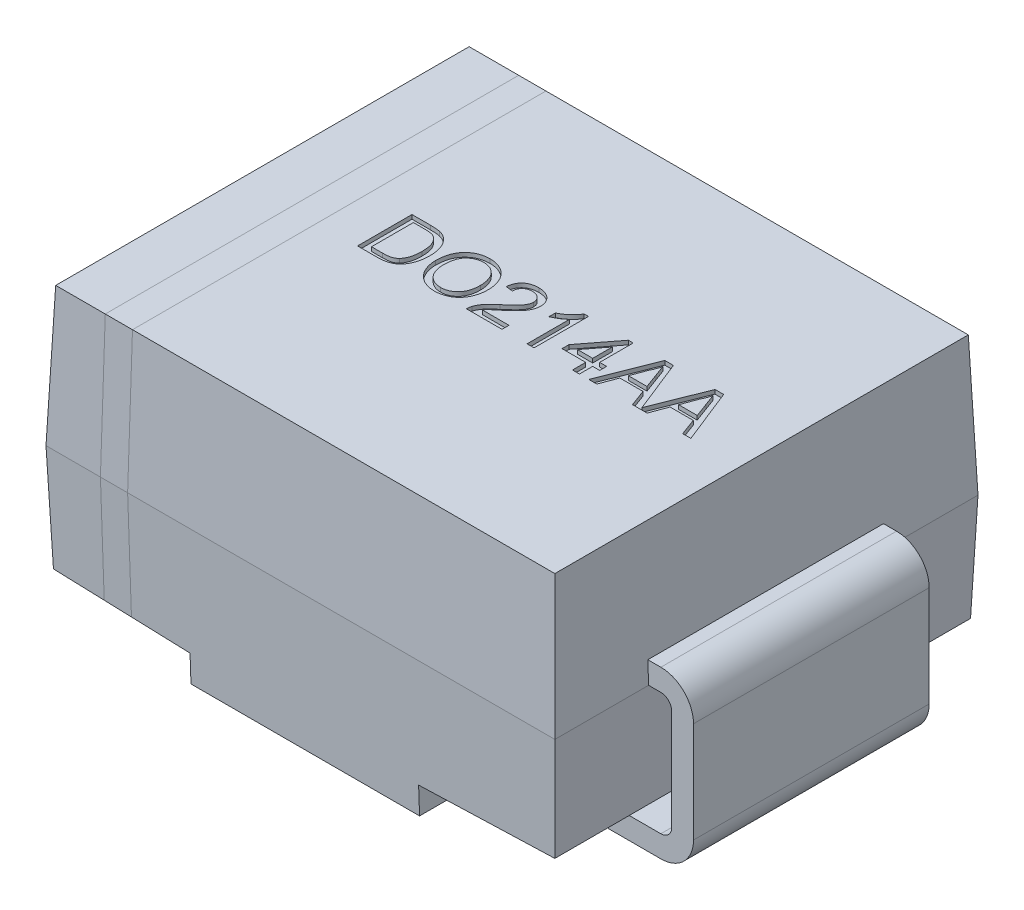
from build123d import *

# Parameters (mm, degrees)
SKETCH1_W                      = 4.7498
SKETCH1_H                      = 3.9497
EXTRUDE1_DEPTH                 = 1.2954
EXTRUDE1_TAPER                 = 2
EXTRUDE1_OTHER_WAY_DEPTH       = 1.2954
EXTRUDE1_OTHER_WAY_TAPER       = 2
CUT_EXTRUDE1_REACH             = 5.349
CUT_EXTRUDE1_DIRECTION_2_REACH = 5.349
EXTRUDE2_DEPTH                 = 1.09982
CUT_EXTRUDE2_DEPTH             = 0.0381


with BuildPart() as part:
    # Sketch1 → Extrude1 (new body)
    with BuildSketch(Plane(origin=(0, 0, 0), x_dir=(1, 0, 0), z_dir=(0, 1, 0))):
        Rectangle(SKETCH1_W, SKETCH1_H)
    extrude(amount=EXTRUDE1_DEPTH, taper=EXTRUDE1_TAPER)

    # Sketch1 → Extrude1 other way (add)
    with BuildSketch(Plane(origin=(0, 0, 0), x_dir=(1, 0, 0), z_dir=(0, 1, 0))):
        Rectangle(SKETCH1_W, SKETCH1_H)
    extrude(amount=-EXTRUDE1_OTHER_WAY_DEPTH, taper=EXTRUDE1_OTHER_WAY_TAPER)

    # Cut-Extrude1: up to this plane
    cut_extrude1_end = Plane(origin=(-2.3749, 0, 1.97485), z_dir=(0, -0.03489949670250105, 0.9993908270190958))
    # Sketch2 → Cut-Extrude1 (cut, up to the surface)
    with BuildSketch(Plane.XY, mode=Mode.PRIVATE) as cut_extrude1_sk1:
        Polygon((1.0668, -1.0414), (1.0668, -1.2954), (2.329663635, -1.2954), (2.340086232, -0.996935865), align=None)
    cut_extrude1_tool1 = split(extrude(cut_extrude1_sk1.sketch, amount=CUT_EXTRUDE1_REACH, mode=Mode.PRIVATE), bisect_by=cut_extrude1_end, keep=Keep.BOTH, mode=Mode.PRIVATE)
    add(cut_extrude1_tool1.solids().sort_by_distance((1.717786, -1.156813, 0))[0], mode=Mode.SUBTRACT)
    # Sketch2 → Cut-Extrude1 (cut, up to the surface)
    with BuildSketch(Plane.XY, mode=Mode.PRIVATE) as cut_extrude1_sk2:
        Polygon((-1.0668, -1.0414), (-1.0668, -1.2954), (-2.329663635, -1.2954), (-2.340086232, -0.996935865), align=None)
    cut_extrude1_tool2 = split(extrude(cut_extrude1_sk2.sketch, amount=CUT_EXTRUDE1_REACH, mode=Mode.PRIVATE), bisect_by=cut_extrude1_end, keep=Keep.BOTH, mode=Mode.PRIVATE)
    add(cut_extrude1_tool2.solids().sort_by_distance((-1.717786, -1.156813, 0))[0], mode=Mode.SUBTRACT)

    # Cut-Extrude1 direction 2: up to this plane
    cut_extrude1_direction_2_end = Plane(origin=(-2.3749, 0, -1.97485), z_dir=(0, -0.034899496702501046, -0.9993908270190958))
    # Sketch2 → Cut-Extrude1 direction 2 (cut, up to the surface)
    with BuildSketch(Plane.XY, mode=Mode.PRIVATE) as cut_extrude1_direction_2_sk1:
        Polygon((1.0668, -1.0414), (1.0668, -1.2954), (2.329663635, -1.2954), (2.340086232, -0.996935865), align=None)
    cut_extrude1_direction_2_tool1 = split(extrude(cut_extrude1_direction_2_sk1.sketch, amount=-CUT_EXTRUDE1_DIRECTION_2_REACH, mode=Mode.PRIVATE), bisect_by=cut_extrude1_direction_2_end, keep=Keep.BOTH, mode=Mode.PRIVATE)
    add(cut_extrude1_direction_2_tool1.solids().sort_by_distance((1.717786, -1.156813, 0))[0], mode=Mode.SUBTRACT)
    # Sketch2 → Cut-Extrude1 direction 2 (cut, up to the surface)
    with BuildSketch(Plane.XY, mode=Mode.PRIVATE) as cut_extrude1_direction_2_sk2:
        Polygon((-1.0668, -1.0414), (-1.0668, -1.2954), (-2.329663635, -1.2954), (-2.340086232, -0.996935865), align=None)
    cut_extrude1_direction_2_tool2 = split(extrude(cut_extrude1_direction_2_sk2.sketch, amount=-CUT_EXTRUDE1_DIRECTION_2_REACH, mode=Mode.PRIVATE), bisect_by=cut_extrude1_direction_2_end, keep=Keep.BOTH, mode=Mode.PRIVATE)
    add(cut_extrude1_direction_2_tool2.solids().sort_by_distance((-1.717786, -1.156813, 0))[0], mode=Mode.SUBTRACT)

    # Sketch3 → Extrude2 (add, symmetric)
    with BuildSketch(Plane.XY):
        with BuildLine():
            Line((2.3678041, 0.2032), (2.4892, 0.2032))
            ThreePointArc((2.4892, 0.2032), (2.704726147, 0.113926147), (2.794, -0.1016))
            Line((2.794, -0.1016), (2.794, -1.0414))
            ThreePointArc((2.794, -1.0414), (2.704726147, -1.256926147), (2.4892, -1.3462))
            Line((2.4892, -1.3462), (1.5367, -1.3462))
            Line((1.5367, -1.3462), (1.5367, -1.143))
            Line((1.5367, -1.143), (2.4892, -1.143))
            ThreePointArc((2.4892, -1.143), (2.561042049, -1.113242049), (2.5908, -1.0414))
            Line((2.5908, -1.0414), (2.5908, -0.1016))
            ThreePointArc((2.5908, -0.1016), (2.561042049, -0.029757951), (2.4892, 0))
            Line((2.4892, 0), (2.3749, 0))
            Line((2.3749, 0), (2.3678041, 0.2032))
        make_face()
        with BuildLine():
            Line((-2.367463797, 0.212944979), (-2.3749, 0))
            Line((-2.3749, 0), (-2.4892, 0))
            ThreePointArc((-2.4892, 0), (-2.561042049, -0.029757951), (-2.5908, -0.1016))
            Line((-2.5908, -0.1016), (-2.5908, -1.0414))
            ThreePointArc((-2.5908, -1.0414), (-2.561042049, -1.113242049), (-2.4892, -1.143))
            Line((-2.4892, -1.143), (-1.5367, -1.143))
            Line((-1.5367, -1.143), (-1.5367, -1.3462))
            Line((-1.5367, -1.3462), (-2.4892, -1.3462))
            ThreePointArc((-2.4892, -1.3462), (-2.704726147, -1.256926147), (-2.794, -1.0414))
            Line((-2.794, -1.0414), (-2.794, -0.1016))
            ThreePointArc((-2.794, -0.1016), (-2.704726147, 0.113926147), (-2.4892, 0.2032))
            Line((-2.4892, 0.2032), (-2.367463797, 0.212944979))
        make_face()
    extrude(amount=EXTRUDE2_DEPTH, both=True)

    # Sketch5 → Cut-Extrude2 (cut)
    # profile 1 of 7: a face of its own
    with BuildSketch(Plane(origin=(0, 1.2954, 0), x_dir=(1, 0, 0), z_dir=(0, 1, 0))):
        with BuildLine():
            Line((-1.239701999, -0.201883132), (-1.239701999, 0.306116868))
            Line((-1.239701999, 0.306116868), (-1.065992864, 0.306116868))
            add(Edge.make_bspline(
                [(-1.065992864, 0.306116868), (-1.061243888, 0.306095414), (-1.052016264, 0.306053727), (-1.038612202, 0.305788039), (-1.026061099, 0.305147202), (-1.014420787, 0.304366578), (-1.003632561, 0.303327244), (-0.993710201, 0.30216501), (-0.984645968, 0.300649027), (-0.978947184, 0.299388963), (-0.976238057, 0.298789945)],
                knots=[0, 0, 0, 0, 1.263127796, 2.454354013, 3.565393221, 4.605443485, 5.557051711, 6.447822442, 7.26211484, 8, 8, 8, 8], degree=3))
            add(Edge.make_bspline(
                [(-0.976238057, 0.298789945), (-0.969231785, 0.296951768), (-0.95546728, 0.293340489), (-0.936037234, 0.285217384), (-0.918199605, 0.275028432), (-0.907620769, 0.266635663), (-0.902358249, 0.262460618)],
                knots=[0, 0, 0, 0, 1.04477941, 2.052571232, 3.03123721, 4, 4, 4, 4], degree=3))
            add(Edge.make_bspline(
                [(-0.902358249, 0.262460618), (-0.89909078, 0.25959125), (-0.892541052, 0.253839526), (-0.88354504, 0.24436314), (-0.875199588, 0.234310235), (-0.86725543, 0.22385388), (-0.860220668, 0.212612863), (-0.853626566, 0.200910731), (-0.847874912, 0.188512489), (-0.842580601, 0.175620761), (-0.837863731, 0.162185298), (-0.833988043, 0.148214777), (-0.83042752, 0.133855083), (-0.827779317, 0.11894925), (-0.825467573, 0.103623709), (-0.824000015, 0.087790743), (-0.823047815, 0.071497617), (-0.822937469, 0.060462837), (-0.822881486, 0.054864464)],
                knots=[0, 0, 0, 0, 0.908997367, 1.822109427, 2.728529095, 3.640759027, 4.565643067, 5.499218265, 6.448003669, 7.421473682, 8.413047621, 9.423472075, 10.452328391, 11.505545429, 12.587978234, 13.692612971, 14.829372988, 16, 16, 16, 16], degree=3))
            add(Edge.make_bspline(
                [(-0.822881486, 0.054864464), (-0.823017946, 0.045495698), (-0.823283494, 0.027264299), (-0.825909664, 0.000747068), (-0.829973439, -0.024178261), (-0.835887689, -0.047362018), (-0.843171704, -0.06867562), (-0.851117933, -0.088293138), (-0.860264607, -0.105876545), (-0.870298303, -0.121574478), (-0.881049143, -0.135486258), (-0.892311923, -0.147820678), (-0.904120032, -0.158583197), (-0.916413485, -0.168056265), (-0.929830751, -0.175900226), (-0.944231069, -0.182943442), (-0.960081634, -0.188602663), (-0.977083949, -0.193552909), (-0.995437713, -0.197261514), (-1.01504354, -0.199986716), (-1.035978483, -0.20163468), (-1.050352268, -0.20179871), (-1.057750076, -0.201883132)],
                knots=[0, 0, 0, 0, 1.410753827, 2.745293735, 4.009435601, 5.211453015, 6.344066657, 7.400119332, 8.396481539, 9.324811333, 10.202671465, 11.041621015, 11.837259285, 12.606727868, 13.374311266, 14.17412185, 15.017911533, 15.905707008, 16.839601966, 17.835295848, 18.885883805, 20, 20, 20, 20], degree=3))
            Line((-1.057750076, -0.201883132), (-1.239701999, -0.201883132))
        make_face()
        with BuildLine():
            Line((-1.168060973, -0.143267747), (-1.063347031, -0.143267747))
            add(Edge.make_bspline(
                [(-1.063347031, -0.143267747), (-1.055711551, -0.143153447), (-1.041266923, -0.142937217), (-1.020887835, -0.141276575), (-1.003101588, -0.138412191), (-0.987710951, -0.134336945), (-0.974357171, -0.129067027), (-0.962599102, -0.122836724), (-0.952140153, -0.115766731), (-0.946248626, -0.110110441), (-0.943368665, -0.107345472)],
                knots=[0, 0, 0, 0, 1.423649224, 2.693227144, 3.808972214, 4.778671344, 5.656058397, 6.479437267, 7.256702014, 8, 8, 8, 8], degree=3))
            add(Edge.make_bspline(
                [(-0.943368665, -0.107345472), (-0.939620972, -0.103060267), (-0.93192192, -0.094256983), (-0.922334603, -0.078878113), (-0.913973997, -0.06157394), (-0.906985005, -0.04216025), (-0.901254212, -0.020702708), (-0.897431992, 0.002990885), (-0.894932992, 0.028759424), (-0.894662746, 0.04668306), (-0.894522512, 0.055983855)],
                knots=[0, 0, 0, 0, 0.782184731, 1.606876467, 2.483531085, 3.422528604, 4.441347086, 5.534669947, 6.720709839, 8, 8, 8, 8], degree=3))
            add(Edge.make_bspline(
                [(-0.894522512, 0.055983855), (-0.8946094, 0.062463826), (-0.894778307, 0.075060626), (-0.895831299, 0.093412052), (-0.89791006, 0.11058715), (-0.900568601, 0.126615628), (-0.904198421, 0.141446535), (-0.908349183, 0.155221969), (-0.913570985, 0.16776185), (-0.9195297, 0.179162987), (-0.92606648, 0.189501095), (-0.93287804, 0.19899823), (-0.939999237, 0.207623254), (-0.947580964, 0.215253449), (-0.955395306, 0.222114456), (-0.963587943, 0.228065808), (-0.972135949, 0.233105676), (-0.978142578, 0.23572191), (-0.981122672, 0.237019913)],
                knots=[0, 0, 0, 0, 1.460126857, 2.838427476, 4.139102445, 5.35666337, 6.496721546, 7.577303074, 8.594995104, 9.55219858, 10.472533725, 11.348579167, 12.184287935, 12.989560785, 13.769667798, 14.524891986, 15.268148459, 16, 16, 16, 16], degree=3))
            add(Edge.make_bspline(
                [(-0.981122672, 0.237019913), (-0.983451199, 0.237872053), (-0.988385196, 0.239677682), (-0.996437956, 0.241721383), (-1.005424918, 0.243602154), (-1.015434664, 0.24492221), (-1.026416568, 0.24620516), (-1.038438894, 0.246984783), (-1.051438591, 0.247338087), (-1.060429648, 0.247445805), (-1.065076999, 0.247501483)],
                knots=[0, 0, 0, 0, 0.699400087, 1.48198292, 2.341906832, 3.289648813, 4.329964754, 5.462247508, 6.688271602, 8, 8, 8, 8], degree=3))
            Line((-1.065076999, 0.247501483), (-1.168060973, 0.247501483))
            Line((-1.168060973, 0.247501483), (-1.168060973, -0.143267747))
        make_face(mode=Mode.SUBTRACT)
    # profile 2 of 7: a face of its own
    with BuildSketch(Plane(origin=(0, 1.2954, 0), x_dir=(1, 0, 0), z_dir=(0, 1, 0))):
        with BuildLine():
            add(Edge.make_bspline(
                [(-0.757753281, 0.045400522), (-0.75757672, 0.055585484), (-0.757232699, 0.075430366), (-0.754018329, 0.104327072), (-0.748799016, 0.131515092), (-0.741337548, 0.156992308), (-0.731880115, 0.180798644), (-0.720382798, 0.202988005), (-0.706499766, 0.223309223), (-0.69079452, 0.241955744), (-0.673252481, 0.258440635), (-0.654575195, 0.27308158), (-0.634529442, 0.285293859), (-0.613300429, 0.295377175), (-0.590797963, 0.303118853), (-0.567085224, 0.308538733), (-0.542187573, 0.312035082), (-0.525169446, 0.312428607), (-0.516473633, 0.312629689)],
                knots=[0, 0, 0, 0, 1.203621547, 2.345195544, 3.432004029, 4.472479546, 5.478447225, 6.455936844, 7.420185704, 8.381829745, 9.332027588, 10.260832629, 11.182364398, 12.100723901, 13.034044877, 13.989196293, 14.972532542, 16, 16, 16, 16], degree=3))
            add(Edge.make_bspline(
                [(-0.516473633, 0.312629689), (-0.510738148, 0.312529536), (-0.49934851, 0.312330652), (-0.482509948, 0.310817406), (-0.466104077, 0.308116525), (-0.450147054, 0.304497041), (-0.434595443, 0.299748436), (-0.419439958, 0.294142853), (-0.404813267, 0.287196745), (-0.390618063, 0.279419886), (-0.37702191, 0.270721134), (-0.36424428, 0.261111639), (-0.352315779, 0.250664079), (-0.341076174, 0.239550183), (-0.330900516, 0.227394872), (-0.321368422, 0.214568418), (-0.312753803, 0.200843388), (-0.305026092, 0.186332234), (-0.298116732, 0.171259078), (-0.292211351, 0.155561449), (-0.287140507, 0.139427651), (-0.282895784, 0.122762188), (-0.27985008, 0.105570759), (-0.277424753, 0.087927438), (-0.276148236, 0.069774563), (-0.275920087, 0.057511973), (-0.275804563, 0.051302765)],
                knots=[0, 0, 0, 0, 1.034375294, 2.054082248, 3.045783978, 4.031219655, 5.002789406, 5.976610191, 6.94273282, 7.920236376, 8.894345378, 9.851183672, 10.800797181, 11.752517031, 12.698794154, 13.65688337, 14.632873302, 15.61821402, 16.620222298, 17.621258913, 18.640965868, 19.669244166, 20.720417492, 21.788124603, 22.880008887, 24, 24, 24, 24], degree=3))
            add(Edge.make_bspline(
                [(-0.275804563, 0.051302765), (-0.275910408, 0.044991168), (-0.276119524, 0.03252152), (-0.277534486, 0.014100034), (-0.280022481, -0.003792609), (-0.283322383, -0.021209763), (-0.287744151, -0.038115167), (-0.292998743, -0.054557291), (-0.299354469, -0.070438203), (-0.306532555, -0.085796178), (-0.314654557, -0.100419991), (-0.323613676, -0.114207386), (-0.333416259, -0.127029392), (-0.343913407, -0.139043303), (-0.355350255, -0.150034288), (-0.367585974, -0.160105119), (-0.380573518, -0.169350778), (-0.394356518, -0.177520861), (-0.40868762, -0.184682231), (-0.423283234, -0.191035657), (-0.438154202, -0.196454111), (-0.453351348, -0.200845229), (-0.468833215, -0.204163474), (-0.484556237, -0.206648211), (-0.500571955, -0.208078932), (-0.511348839, -0.208289736), (-0.516778922, -0.208395953)],
                knots=[0, 0, 0, 0, 1.141429366, 2.255090526, 3.338676798, 4.407031443, 5.458968682, 6.496860253, 7.526652771, 8.550250826, 9.560787671, 10.54935636, 11.521089193, 12.477323897, 13.431786008, 14.386110112, 15.340986122, 16.312041, 17.28047646, 18.236612773, 19.189437236, 20.140779471, 21.09494583, 22.051062463, 23.018000708, 24, 24, 24, 24], degree=3))
            add(Edge.make_bspline(
                [(-0.516778922, -0.208395953), (-0.522617467, -0.208309571), (-0.534182162, -0.208138469), (-0.551275094, -0.206430589), (-0.56794278, -0.203825157), (-0.584136765, -0.200063701), (-0.59983492, -0.195156616), (-0.615055821, -0.189217236), (-0.629852999, -0.182324938), (-0.644042848, -0.174282374), (-0.65757707, -0.165339907), (-0.670324487, -0.15554199), (-0.682278049, -0.144978919), (-0.693245952, -0.1334761), (-0.703583412, -0.121450514), (-0.712877089, -0.108455178), (-0.721430501, -0.094784811), (-0.728990539, -0.080307639), (-0.735819902, -0.065453866), (-0.741573788, -0.050218743), (-0.746630338, -0.034826795), (-0.750657369, -0.019183151), (-0.753866422, -0.003323898), (-0.756024278, 0.012724574), (-0.757582698, 0.028986168), (-0.757696134, 0.039901536), (-0.757753281, 0.045400522)],
                knots=[0, 0, 0, 0, 1.072727997, 2.12480551, 3.153819198, 4.171534612, 5.177148798, 6.173931848, 7.17235114, 8.174500385, 9.168706755, 10.151274001, 11.127173509, 12.097141049, 13.070188938, 14.039134204, 15.03036519, 16.031505612, 17.038625933, 18.033164522, 19.022845559, 20.014762458, 21.000193215, 21.994692725, 22.989758729, 24, 24, 24, 24], degree=3))
        make_face()
        with BuildLine():
            add(Edge.make_bspline(
                [(-0.686112255, 0.044586419), (-0.686002469, 0.037252328), (-0.685788393, 0.022951366), (-0.683339249, 0.002101325), (-0.679623064, -0.01757175), (-0.674500696, -0.036123087), (-0.667614978, -0.053369216), (-0.659382211, -0.069475854), (-0.649525196, -0.084335935), (-0.638261407, -0.097907889), (-0.62587253, -0.110099915), (-0.612633758, -0.120749002), (-0.598542115, -0.129666858), (-0.583753832, -0.137030453), (-0.56816269, -0.14277841), (-0.551815387, -0.14681448), (-0.53469991, -0.149338715), (-0.523029266, -0.149631449), (-0.51708421, -0.149780568)],
                knots=[0, 0, 0, 0, 1.215430442, 2.370003584, 3.475209778, 4.53279855, 5.55522989, 6.548792651, 7.526809858, 8.505409025, 9.467826767, 10.404123909, 11.316848639, 12.227335424, 13.138360512, 14.065900994, 15.014765094, 16, 16, 16, 16], degree=3))
            add(Edge.make_bspline(
                [(-0.51708421, -0.149780568), (-0.511038386, -0.149629243), (-0.499200678, -0.149332949), (-0.481827163, -0.14685278), (-0.465320378, -0.142630397), (-0.449516712, -0.13700945), (-0.434701881, -0.129410887), (-0.420529407, -0.120513011), (-0.407385635, -0.109640062), (-0.394947921, -0.097426472), (-0.383792129, -0.083543485), (-0.373893713, -0.068333082), (-0.365852936, -0.051567145), (-0.35891081, -0.033615006), (-0.353827386, -0.014137362), (-0.350070424, 0.006644365), (-0.347806399, 0.028797024), (-0.347567985, 0.044004413), (-0.347445589, 0.05181158)],
                knots=[0, 0, 0, 0, 0.976878588, 1.912725521, 2.8289017, 3.727303729, 4.617335839, 5.514666588, 6.426584173, 7.368641557, 8.327632997, 9.299405846, 10.294892156, 11.327373912, 12.405931897, 13.542618837, 14.738430195, 16, 16, 16, 16], degree=3))
            add(Edge.make_bspline(
                [(-0.347445589, 0.05181158), (-0.347488844, 0.056834202), (-0.347573694, 0.06668677), (-0.348697399, 0.081209568), (-0.350146835, 0.095280623), (-0.352353624, 0.10888178), (-0.355394858, 0.121956712), (-0.35876403, 0.13460496), (-0.362977061, 0.146717528), (-0.367757332, 0.158341916), (-0.373106374, 0.169418447), (-0.379139382, 0.179853742), (-0.385786241, 0.18960723), (-0.392867609, 0.198863829), (-0.400775613, 0.207265268), (-0.409129479, 0.21516643), (-0.418118964, 0.222404075), (-0.427654355, 0.228980092), (-0.437600382, 0.234899544), (-0.447936541, 0.239965827), (-0.458498161, 0.24441592), (-0.46946203, 0.247827104), (-0.480676757, 0.250578273), (-0.492187678, 0.252668042), (-0.50403752, 0.253750222), (-0.512028101, 0.253925644), (-0.516066582, 0.254014304)],
                knots=[0, 0, 0, 0, 1.220438779, 2.394059227, 3.538503547, 4.658058814, 5.74010225, 6.800155734, 7.837851593, 8.854470756, 9.853724944, 10.825214244, 11.781044712, 12.72106398, 13.654479919, 14.581868691, 15.514082315, 16.456304431, 17.39516604, 18.324312202, 19.252140633, 20.177768678, 21.111585046, 22.057694709, 23.018348693, 24, 24, 24, 24], degree=3))
            add(Edge.make_bspline(
                [(-0.516066582, 0.254014304), (-0.521774425, 0.253900948), (-0.533036635, 0.253677285), (-0.549615948, 0.251190923), (-0.565600204, 0.247475959), (-0.581014207, 0.242282241), (-0.595726126, 0.235404941), (-0.60981218, 0.226970875), (-0.623397404, 0.217209688), (-0.636267579, 0.205883551), (-0.648265397, 0.192872584), (-0.658408349, 0.177533053), (-0.666957105, 0.160231145), (-0.67409516, 0.141010715), (-0.679537716, 0.119722914), (-0.683299203, 0.096459355), (-0.685674129, 0.071195522), (-0.68596248, 0.053682874), (-0.686112255, 0.044586419)],
                knots=[0, 0, 0, 0, 0.895090134, 1.766112571, 2.624765742, 3.468151641, 4.313618154, 5.168136083, 6.041303099, 6.935189387, 7.854749729, 8.809996334, 9.809869957, 10.877771942, 12.021723904, 13.25217762, 14.572720513, 16, 16, 16, 16], degree=3))
        make_face(mode=Mode.SUBTRACT)
    # profile 3 of 7: a face of its own
    with BuildSketch(Plane(origin=(0, 1.2954, 0), x_dir=(1, 0, 0), z_dir=(0, 1, 0))):
        with BuildLine():
            Line((0.108451847, -0.136754927), (0.108451847, -0.201883132))
            Line((0.108451847, -0.201883132), (-0.223701999, -0.201883132))
            add(Edge.make_bspline(
                [(-0.223701999, -0.201883132), (-0.223708799, -0.19801238), (-0.223722376, -0.190283849), (-0.222414584, -0.178853842), (-0.22036632, -0.167575464), (-0.218050349, -0.160343089), (-0.21688389, -0.15670044)],
                knots=[0, 0, 0, 0, 1.01057331, 2.01775941, 3.001627217, 4, 4, 4, 4], degree=3))
            add(Edge.make_bspline(
                [(-0.21688389, -0.15670044), (-0.214728661, -0.150748786), (-0.210340261, -0.138630238), (-0.201449316, -0.121144867), (-0.190991464, -0.103765243), (-0.180809273, -0.089615776), (-0.171484585, -0.07831134), (-0.163664619, -0.069466928), (-0.154998662, -0.06041363), (-0.145493656, -0.051153099), (-0.13524108, -0.04162536), (-0.124226944, -0.031798637), (-0.112321189, -0.021856062), (-0.104009726, -0.01526571), (-0.099754883, -0.011891946)],
                knots=[0, 0, 0, 0, 1.204657718, 2.452881516, 3.728232997, 5.065887527, 5.768225529, 6.518857853, 7.313994055, 8.154655305, 9.046094665, 9.979688118, 10.965752482, 12, 12, 12, 12], degree=3))
            add(Edge.make_bspline(
                [(-0.099754883, -0.011891946), (-0.093218394, -0.006390289), (-0.080631968, 0.004203501), (-0.062857963, 0.019923704), (-0.046624302, 0.034520803), (-0.032189488, 0.048250642), (-0.01943546, 0.06098005), (-0.008332271, 0.072680187), (0.001215614, 0.083314539), (0.009091635, 0.093268026), (0.015736875, 0.102666886), (0.02136813, 0.111834894), (0.026061033, 0.120932194), (0.029969593, 0.12993), (0.033060933, 0.138866791), (0.03516812, 0.147768604), (0.036597142, 0.156547111), (0.036740117, 0.162388427), (0.036810822, 0.165277124)],
                knots=[0, 0, 0, 0, 1.782554561, 3.432421876, 4.950675607, 6.337395053, 7.588547463, 8.709982106, 9.702713005, 10.569305638, 11.356701089, 12.103210377, 12.812277205, 13.490692607, 14.148717897, 14.782152033, 15.397739362, 16, 16, 16, 16], degree=3))
            add(Edge.make_bspline(
                [(0.036810822, 0.165277124), (0.036740108, 0.168132117), (0.036601372, 0.173733459), (0.035285049, 0.181930986), (0.033452622, 0.189825402), (0.030490145, 0.197274587), (0.026963906, 0.204499143), (0.022440653, 0.211270782), (0.017208179, 0.21775827), (0.01121744, 0.223790564), (0.004674149, 0.229449818), (-0.002637045, 0.234154034), (-0.010235947, 0.238389229), (-0.018384711, 0.241794569), (-0.027070097, 0.244295171), (-0.036228878, 0.246109964), (-0.045859602, 0.24726064), (-0.052431894, 0.247419985), (-0.055793345, 0.247501483)],
                knots=[0, 0, 0, 0, 0.988194508, 1.938783882, 2.870742509, 3.789494954, 4.709148727, 5.651055405, 6.603531303, 7.592354411, 8.592907906, 9.593461401, 10.59787167, 11.603930315, 12.645063138, 13.723588815, 14.835711238, 16, 16, 16, 16], degree=3))
            add(Edge.make_bspline(
                [(-0.055793345, 0.247501483), (-0.059324456, 0.247420389), (-0.066235101, 0.24726168), (-0.076336612, 0.246106415), (-0.085926246, 0.244341326), (-0.094981114, 0.241642656), (-0.103490194, 0.238242995), (-0.111418832, 0.233963727), (-0.118893997, 0.229133207), (-0.125680269, 0.223414235), (-0.131817005, 0.217073063), (-0.137264998, 0.210169444), (-0.14172881, 0.202570154), (-0.14541521, 0.194442283), (-0.148379384, 0.185760281), (-0.150531273, 0.176457775), (-0.151704498, 0.166561626), (-0.151940423, 0.159784746), (-0.152060973, 0.156321996)],
                knots=[0, 0, 0, 0, 1.131143733, 2.213731411, 3.253917892, 4.251203413, 5.236093891, 6.184197493, 7.13373276, 8.082770301, 9.020476205, 9.957489029, 10.893177274, 11.836722509, 12.812818608, 13.827831385, 14.890097571, 16, 16, 16, 16], degree=3))
            Line((-0.152060973, 0.156321996), (-0.217189178, 0.162834817))
            add(Edge.make_bspline(
                [(-0.217189178, 0.162834817), (-0.216522824, 0.168510899), (-0.21522649, 0.179553228), (-0.211997497, 0.195546182), (-0.207464284, 0.210424214), (-0.202039913, 0.224394754), (-0.195239951, 0.237219983), (-0.18755318, 0.249165174), (-0.178486989, 0.259851478), (-0.168471252, 0.269615741), (-0.157396238, 0.278220626), (-0.145365978, 0.285738187), (-0.132385975, 0.292026164), (-0.118528524, 0.297232346), (-0.103761811, 0.301182407), (-0.088106727, 0.304014974), (-0.071538095, 0.305761), (-0.060173468, 0.305996553), (-0.054368665, 0.306116868)],
                knots=[0, 0, 0, 0, 1.130804643, 2.199883102, 3.223565206, 4.205909148, 5.160801384, 6.091796021, 7.01151579, 7.927798993, 8.855738875, 9.7815393, 10.730299821, 11.705391175, 12.706931101, 13.751121791, 14.851322166, 16, 16, 16, 16], degree=3))
            add(Edge.make_bspline(
                [(-0.054368665, 0.306116868), (-0.048494382, 0.306016278), (-0.037051244, 0.305820327), (-0.020376753, 0.303815357), (-0.004643909, 0.300692635), (0.010204963, 0.296340516), (0.024082133, 0.290633591), (0.036998278, 0.283661017), (0.04901295, 0.27549081), (0.059925409, 0.266024892), (0.069765459, 0.255691256), (0.078388811, 0.244663039), (0.085598349, 0.232987353), (0.091736823, 0.220823347), (0.096289955, 0.207914002), (0.099491802, 0.194434824), (0.10166755, 0.180374295), (0.101847331, 0.170780763), (0.101939027, 0.165887701)],
                knots=[0, 0, 0, 0, 1.195390245, 2.328627238, 3.413424916, 4.457841177, 5.473507151, 6.462241215, 7.441013641, 8.425227782, 9.397253344, 10.342087291, 11.269524934, 12.186751184, 13.110685745, 14.048630397, 15.004728144, 16, 16, 16, 16], degree=3))
            add(Edge.make_bspline(
                [(0.101939027, 0.165887701), (0.10179901, 0.160860635), (0.101518666, 0.150795408), (0.099330547, 0.135750862), (0.09558665, 0.120869583), (0.090623243, 0.105970457), (0.083842195, 0.090994349), (0.075275493, 0.075734664), (0.064647563, 0.060135034), (0.054426474, 0.046873616), (0.044912299, 0.035757203), (0.036478882, 0.026607746), (0.026721906, 0.016887059), (0.016007393, 0.006258494), (0.003898353, -0.004900721), (-0.009257293, -0.016924754), (-0.023747529, -0.029497178), (-0.033806577, -0.038086055), (-0.03900248, -0.042522555)],
                knots=[0, 0, 0, 0, 0.927118007, 1.856282007, 2.79721255, 3.754929441, 4.749232485, 5.824981375, 6.979078785, 8.228161913, 8.911614355, 9.677694854, 10.522803217, 11.452009355, 12.461436787, 13.560019032, 14.739651695, 16, 16, 16, 16], degree=3))
            add(Edge.make_bspline(
                [(-0.03900248, -0.042522555), (-0.043451985, -0.046144927), (-0.051936508, -0.053052233), (-0.064007386, -0.06306594), (-0.07481922, -0.072248237), (-0.084624845, -0.080299617), (-0.093067146, -0.087609513), (-0.100443491, -0.093857785), (-0.106485894, -0.099358594), (-0.115687403, -0.107714433), (-0.127341899, -0.119624836), (-0.135929431, -0.131197843), (-0.14005296, -0.136754927)],
                knots=[0, 0, 0, 0, 1.241996727, 2.368296581, 3.394949853, 4.3125351, 5.114548721, 5.812230366, 6.404953749, 6.883082049, 8.503329734, 10, 10, 10, 10], degree=3))
            Line((-0.14005296, -0.136754927), (0.108451847, -0.136754927))
        make_face()
    # profile 4 of 7: a face of its own
    with BuildSketch(Plane(origin=(0, 1.2954, 0), x_dir=(1, 0, 0), z_dir=(0, 1, 0))):
        with BuildLine():
            Line((0.408041591, -0.201883132), (0.342913386, -0.201883132))
            Line((0.342913386, -0.201883132), (0.342913386, 0.19397424))
            add(Edge.make_bspline(
                [(0.342913386, 0.19397424), (0.339163298, 0.190357741), (0.331369151, 0.182841246), (0.31819397, 0.172203528), (0.303488784, 0.16142175), (0.287444549, 0.151053865), (0.271090166, 0.141293619), (0.25528576, 0.132515779), (0.240295193, 0.125087596), (0.230420826, 0.121025837), (0.225682617, 0.119076804)],
                knots=[0, 0, 0, 0, 0.893362401, 1.856755847, 2.901947673, 4.020460078, 5.132200827, 6.168787962, 7.121294059, 8, 8, 8, 8], degree=3))
            Line((0.225682617, 0.119076804), (0.225682617, 0.179116868))
            add(Edge.make_bspline(
                [(0.225682617, 0.179116868), (0.23382098, 0.183308142), (0.249861213, 0.191568894), (0.272522594, 0.205836348), (0.29367943, 0.221302856), (0.312981493, 0.237964993), (0.330284562, 0.254996688), (0.34486611, 0.272182337), (0.357067022, 0.288891989), (0.36318845, 0.300545118), (0.366115309, 0.306116868)],
                knots=[0, 0, 0, 0, 1.141258006, 2.249351951, 3.335817539, 4.406819942, 5.426913362, 6.360259544, 7.215985427, 8, 8, 8, 8], degree=3))
            Line((0.366115309, 0.306116868), (0.408041591, 0.306116868))
            Line((0.408041591, 0.306116868), (0.408041591, -0.201883132))
        make_face()
    # profile 5 of 7: a face of its own
    with BuildSketch(Plane(origin=(0, 1.2954, 0), x_dir=(1, 0, 0), z_dir=(0, 1, 0))):
        Polygon((0.766246719, -0.201883132), (0.766246719, -0.078139542), (0.544810822, -0.078139542), (0.544810822, -0.013011337), (0.785785181, 0.299604047), (0.831374924, 0.299604047), (0.831374924, -0.013011337), (0.896503129, -0.013011337), (0.896503129, -0.078139542), (0.831374924, -0.078139542), (0.831374924, -0.201883132), align=None)
        Polygon((0.766246719, -0.013011337), (0.766246719, 0.169958214), (0.62520345, -0.013011337), align=None, mode=Mode.SUBTRACT)
    # profile 6 of 7: a face of its own
    with BuildSketch(Plane(origin=(0, 1.2954, 0), x_dir=(1, 0, 0), z_dir=(0, 1, 0))):
        Polygon((0.91817861, -0.201883132), (1.11987252, 0.306116868), (1.2006722, 0.306116868), (1.40236611, -0.201883132), (1.326349283, -0.201883132), (1.268548001, -0.04557544), (1.051996719, -0.04557544), (0.994195437, -0.201883132), align=None)
        with BuildLine():
            Line((1.073570437, 0.013039945), (1.246974283, 0.013039945))
            Line((1.246974283, 0.013039945), (1.197619315, 0.146552765))
            add(Edge.make_bspline(
                [(1.197619315, 0.146552765), (1.195727222, 0.151711519), (1.192027822, 0.161797856), (1.186510903, 0.176452452), (1.181470735, 0.190369058), (1.176528435, 0.20334813), (1.172066934, 0.215578201), (1.167954653, 0.226976664), (1.163887642, 0.237464293), (1.161446972, 0.244240381), (1.16027236, 0.247501483)],
                knots=[0, 0, 0, 0, 1.225184869, 2.395467751, 3.491410812, 4.525364584, 5.492066482, 6.394148129, 7.227157926, 8, 8, 8, 8], degree=3))
            add(Edge.make_bspline(
                [(1.16027236, 0.247501483), (1.158329325, 0.239459893), (1.154435244, 0.223343555), (1.146281986, 0.199730958), (1.136954941, 0.176334308), (1.12938027, 0.161257667), (1.125571238, 0.153676163)],
                knots=[0, 0, 0, 0, 0.9891762, 1.982431084, 2.985436691, 4, 4, 4, 4], degree=3))
            Line((1.125571238, 0.153676163), (1.073570437, 0.013039945))
        make_face(mode=Mode.SUBTRACT)
    # profile 7 of 7: a face of its own
    with BuildSketch(Plane(origin=(0, 1.2954, 0), x_dir=(1, 0, 0), z_dir=(0, 1, 0))):
        Polygon((1.387101687, -0.201883132), (1.588795597, 0.306116868), (1.669595277, 0.306116868), (1.871289187, -0.201883132), (1.79527236, -0.201883132), (1.737471078, -0.04557544), (1.520919796, -0.04557544), (1.463118514, -0.201883132), align=None)
        with BuildLine():
            Line((1.542493514, 0.013039945), (1.71589736, 0.013039945))
            Line((1.71589736, 0.013039945), (1.666542392, 0.146552765))
            add(Edge.make_bspline(
                [(1.666542392, 0.146552765), (1.664650299, 0.151711519), (1.660950899, 0.161797856), (1.65543398, 0.176452452), (1.650393811, 0.190369058), (1.645451512, 0.20334813), (1.640990011, 0.215578201), (1.63687773, 0.226976664), (1.632810719, 0.237464293), (1.630370049, 0.244240381), (1.629195437, 0.247501483)],
                knots=[0, 0, 0, 0, 1.225184869, 2.395467751, 3.491410812, 4.525364584, 5.492066482, 6.394148129, 7.227157926, 8, 8, 8, 8], degree=3))
            add(Edge.make_bspline(
                [(1.629195437, 0.247501483), (1.627252402, 0.239459893), (1.623358321, 0.223343555), (1.615205063, 0.199730958), (1.605878018, 0.176334308), (1.598303347, 0.161257667), (1.594494315, 0.153676163)],
                knots=[0, 0, 0, 0, 0.9891762, 1.982431084, 2.985436691, 4, 4, 4, 4], degree=3))
            Line((1.594494315, 0.153676163), (1.542493514, 0.013039945))
        make_face(mode=Mode.SUBTRACT)
    extrude(amount=-CUT_EXTRUDE2_DEPTH, mode=Mode.SUBTRACT)


solid = part.part
